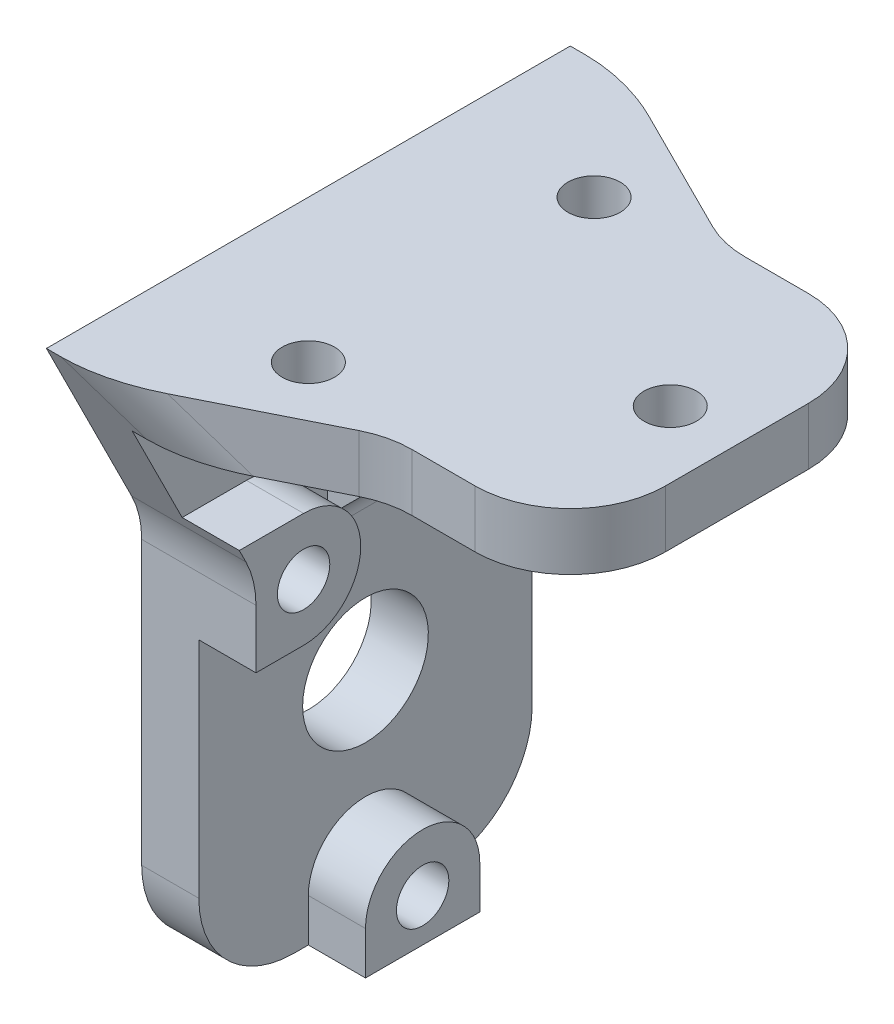
from build123d import *

# Parameters (mm, degrees)
BOSS_EXTRUDE1_DEPTH  = 17.5
SKETCH2_R            = 6.6
CUT_EXTRUDE1_DEPTH   = 20
BOSS_EXTRUDE2_DEPTH  = 4
BOSS_EXTRUDE3_DEPTH  = 6
BOSS_EXTRUDE4_DEPTH  = 6
CUT_EXTRUDE2_DEPTH   = 8
FILLET3_R            = 10
FILLET4_R            = 3
M5_CLEARANCE_HOLE1_D = 5.5
FILLET5_R            = 10
BOSS_EXTRUDE5_START  = 6
BOSS_EXTRUDE5_DEPTH  = 6
M5_CLEARANCE_HOLE2_D = 5.5


with BuildPart() as part:
    # Sketch1 → Boss-Extrude1 (new, symmetric)
    with BuildSketch(Plane.XY):
        Polygon((0, -62), (0, 0), (45, 0), (45, -6), (6, -6), (6, -62), align=None)
    extrude(amount=BOSS_EXTRUDE1_DEPTH, both=True)

    # Sketch2 → Cut-Extrude1 (cut)
    with BuildSketch(Plane.ZY):
        with Locations((0, -40)):
            Circle(SKETCH2_R)
    extrude(amount=-CUT_EXTRUDE1_DEPTH, mode=Mode.SUBTRACT)

    # Sketch3 → Boss-Extrude2 (add, symmetric)
    with BuildSketch(Plane.XY):
        Polygon((6, -24), (24, -6), (6, -6), align=None)
    extrude(amount=BOSS_EXTRUDE2_DEPTH, both=True)

    # Sketch4 → Boss-Extrude3 (add)
    with BuildSketch(Plane.ZY):
        Polygon((17.5, -20), (27.5, 0), (17.5, 0), align=None)
    boss_extrude3 = extrude(amount=-BOSS_EXTRUDE3_DEPTH)

    # Sketch5 → Boss-Extrude4 (add)
    with BuildSketch(Plane(origin=(0, 0, 0), x_dir=(1, 0, 0), z_dir=(0, 1, 0))):
        Polygon((6, -27.5), (26, -17.5), (6, -17.5), align=None)
    boss_extrude4 = extrude(amount=-BOSS_EXTRUDE4_DEPTH)

    # Sketch6 → Cut-Extrude2 (cut)
    with BuildSketch(Plane.ZY.offset(-6)):
        Polygon((27.5, 0), (27.5, -6), (24.5, -6), align=None)
    cut_extrude2 = extrude(amount=-CUT_EXTRUDE2_DEPTH, mode=Mode.SUBTRACT)

    # Mirror2: Boss-Extrude3, Boss-Extrude4, Cut-Extrude2 across plane
    add(boss_extrude3.mirror(Plane.XY))
    add(boss_extrude4.mirror(Plane.XY))
    add(cut_extrude2.mirror(Plane.XY), mode=Mode.SUBTRACT)

    # Fillet3
    fillet3_edges = [part.edges().sort_by_distance(p)[0] for p in [
        (3, -20, 17.5),
        (26, -3, 17.5),
        (9, -3, 26),
        (3, -20, -17.5),
        (26, -3, -17.5),
        (9, -3, -26),
    ]]
    fillet(fillet3_edges, radius=FILLET3_R)

    # Fillet4
    fillet4_edges = [part.edges().sort_by_distance(p)[0] for p in [
        (6, -24, 0),
        (24, -6, 0),
    ]]
    fillet(fillet4_edges, radius=FILLET4_R)

    # M5 Clearance Hole1 (through all)
    with Locations(Plane(origin=(0, -6, 0), x_dir=(-1, 0, 0), z_dir=(0, -1, 0))):
        with Locations((-15, 15), (-15, -15), (-38, 0)):
            Hole(M5_CLEARANCE_HOLE1_D / 2)

    # Fillet5
    fillet5_edges = [part.edges().sort_by_distance(p)[0] for p in [
        (45, -3, 17.5),
        (3, -62, 17.5),
        (45, -3, -17.5),
        (3, -62, -17.5),
    ]]
    fillet(fillet5_edges, radius=FILLET5_R)

    # Sketch11 → Boss-Extrude5 (add)
    with BuildSketch(Plane(origin=(6, 0, 0), x_dir=(0, 0, -1), z_dir=(1, 0, 0)).offset(BOSS_EXTRUDE5_START)):
        with BuildLine():
            Line((17.5, -28.5), (17.5, -22.360679775))
            ThreePointArc((17.5, -22.360679775), (17.767510105, -20.06315057), (18.55572809, -17.88854382))
            Line((18.55572809, -17.88854382), (19.25, -16.5))
            Line((19.25, -16.5), (12.5, -16.5))
            ThreePointArc((12.5, -16.5), (6.5, -22.5), (12.5, -28.5))
            Line((12.5, -28.5), (17.5, -28.5))
        make_face()
        with BuildLine():
            Line((-17.5, -28.5), (-17.5, -22.360679775))
            ThreePointArc((-17.5, -22.360679775), (-17.767510105, -20.06315057), (-18.55572809, -17.88854382))
            Line((-18.55572809, -17.88854382), (-19.25, -16.5))
            Line((-19.25, -16.5), (-12.5, -16.5))
            ThreePointArc((-12.5, -16.5), (-6.5, -22.5), (-12.5, -28.5))
            Line((-12.5, -28.5), (-17.5, -28.5))
        make_face()
        with BuildLine():
            Line((-6, -57.5), (-6, -62))
            Line((-6, -62), (6, -62))
            Line((6, -62), (6, -57.5))
            ThreePointArc((6, -57.5), (0, -51.5), (-6, -57.5))
        make_face()
    extrude(amount=-BOSS_EXTRUDE5_DEPTH)

    # M5 Clearance Hole2 (through all)
    with Locations(Plane(origin=(12, 0, 0), x_dir=(0, 0, -1), z_dir=(1, 0, 0))):
        with Locations((-12.5, -22.5), (12.5, -22.5), (0, -57.5)):
            Hole(M5_CLEARANCE_HOLE2_D / 2)


solid = part.part
